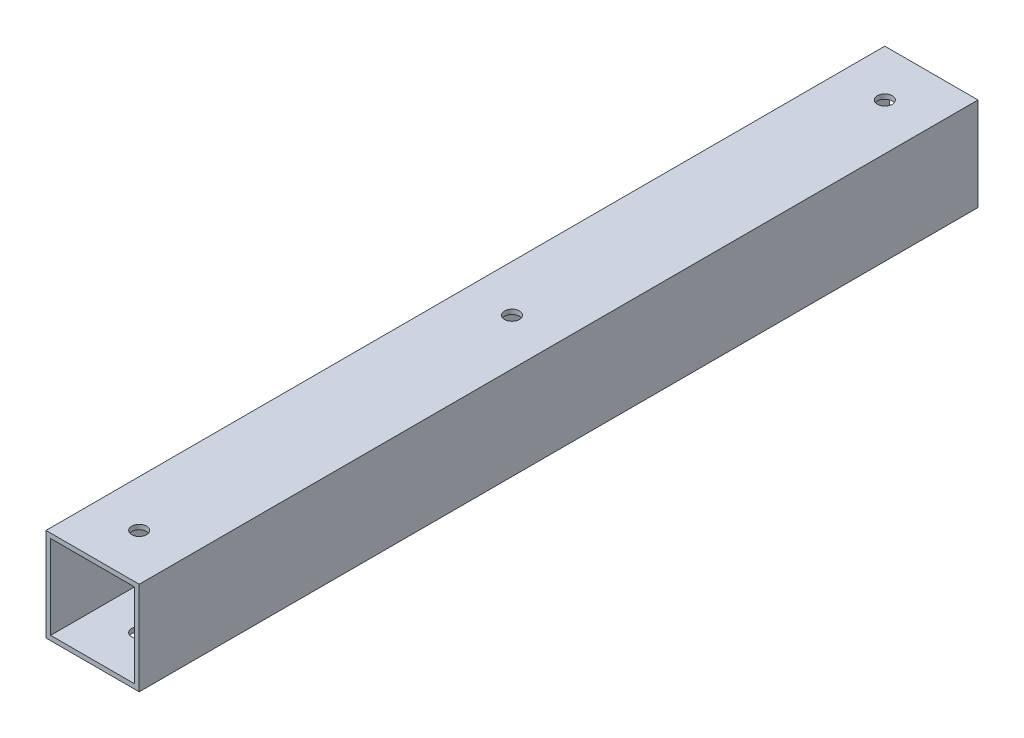
from build123d import *

# Parameters (mm, degrees)
SKETCH_1_W          = 20
SKETCH_1_H          = 20
SKETCH_1_W_2        = 18
SKETCH_1_H_2        = 18
EXTRUDE_1_DEPTH     = 180
SKETCH_2_R          = 1.6
CUT_EXTRUDE_1_DEPTH = 50


with BuildPart() as part:
    # 草图1 → 凸台-拉伸1 (new body)
    with BuildSketch(Plane.XY):
        Rectangle(SKETCH_1_W, SKETCH_1_H)
        Rectangle(SKETCH_1_W_2, SKETCH_1_H_2, mode=Mode.SUBTRACT)
    extrude(amount=EXTRUDE_1_DEPTH)

    # 草图2 → 切除-拉伸1 (cut)
    with BuildSketch(Plane(origin=(0, 10, 0), x_dir=(1, 0, 0), z_dir=(0, 1, 0))):
        with Locations(Location((0, -90, 0), (0, 0, 270))):
            Circle(SKETCH_2_R)
        with Locations(Location((0, -170, 0), (0, 0, 270))):
            Circle(SKETCH_2_R)
        with Locations(Location((0, -10, 0), (0, 0, 270))):
            Circle(SKETCH_2_R)
    extrude(amount=-CUT_EXTRUDE_1_DEPTH, mode=Mode.SUBTRACT)


solid = part.part
